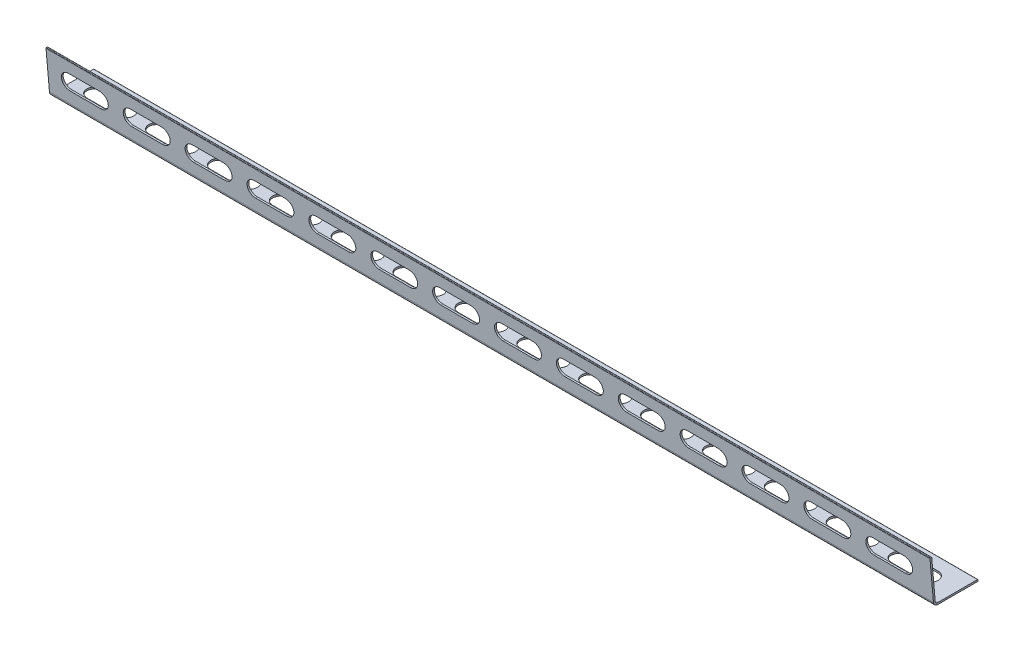
from build123d import *

# Parameters (mm, degrees)
EXTRUDE_1_DEPTH     = 1000
CUT_EXTRUDE_3_DEPTH = 1003.594743762
CUT_EXTRUDE_5_DEPTH = 1003.62092087


with BuildPart() as part:
    # 草图1 → 凸台-拉伸1 (new body)
    with BuildSketch(Plane(origin=(0, 0, 0), x_dir=(0, 0, -1), z_dir=(1, 0, 0))):
        with BuildLine():
            Line((-0.5, 0), (-45.41834413, 0))
            ThreePointArc((-45.41834413, 0), (-48.796295168, 1.313613316), (-50.39931762, 4.564221286))
            Line((-50.39931762, 4.564221286), (-54.314209266, 49.311637556))
            ThreePointArc((-54.314209266, 49.311637556), (-54.199134139, 49.676609232), (-53.859689788, 49.853312776))
            Line((-53.859689788, 49.853312776), (-52.86349509, 49.940468519))
            ThreePointArc((-52.86349509, 49.940468519), (-52.498523414, 49.825393391), (-52.32181987, 49.485949041))
            Line((-52.32181987, 49.485949041), (-48.406928224, 4.738532772))
            ThreePointArc((-48.406928224, 4.738532772), (-47.445114753, 2.78816799), (-45.41834413, 2))
            Line((-45.41834413, 2), (-0.5, 2))
            ThreePointArc((-0.5, 2), (-0.146446609, 1.853553391), (0, 1.5))
            Line((0, 1.5), (0, 0.5))
            ThreePointArc((0, 0.5), (-0.146446609, 0.146446609), (-0.5, 0))
        make_face()
    extrude(amount=EXTRUDE_1_DEPTH)

    # 草图3 → 切除-拉伸3 (cut, through all)
    with BuildSketch(Plane(origin=(0, -4.166892956, 47.627804429), x_dir=(-1, 0, 0), z_dir=(0, 0.08715574274765506, -0.9961946980917459))):
        with BuildLine():
            Line((-59.5, 40.939443007), (-24.5, 40.939443007))
            ThreePointArc((-24.5, 40.939443007), (-15.5, 31.939443007), (-24.5, 22.939443007))
            Line((-24.5, 22.939443007), (-59.5, 22.939443007))
            ThreePointArc((-59.5, 22.939443007), (-68.5, 31.939443007), (-59.5, 40.939443007))
        make_face()
        with BuildLine():
            Line((-129.5, 40.939443007), (-94.5, 40.939443007))
            ThreePointArc((-94.5, 40.939443007), (-85.5, 31.939443007), (-94.5, 22.939443007))
            Line((-94.5, 22.939443007), (-129.5, 22.939443007))
            ThreePointArc((-129.5, 22.939443007), (-138.5, 31.939443007), (-129.5, 40.939443007))
        make_face()
        with BuildLine():
            Line((-199.5, 40.939443007), (-164.5, 40.939443007))
            ThreePointArc((-164.5, 40.939443007), (-155.5, 31.939443007), (-164.5, 22.939443007))
            Line((-164.5, 22.939443007), (-199.5, 22.939443007))
            ThreePointArc((-199.5, 22.939443007), (-208.5, 31.939443007), (-199.5, 40.939443007))
        make_face()
        with BuildLine():
            Line((-269.5, 40.939443007), (-234.5, 40.939443007))
            ThreePointArc((-234.5, 40.939443007), (-225.5, 31.939443007), (-234.5, 22.939443007))
            Line((-234.5, 22.939443007), (-269.5, 22.939443007))
            ThreePointArc((-269.5, 22.939443007), (-278.5, 31.939443007), (-269.5, 40.939443007))
        make_face()
        with BuildLine():
            Line((-339.5, 40.939443007), (-304.5, 40.939443007))
            ThreePointArc((-304.5, 40.939443007), (-295.5, 31.939443007), (-304.5, 22.939443007))
            Line((-304.5, 22.939443007), (-339.5, 22.939443007))
            ThreePointArc((-339.5, 22.939443007), (-348.5, 31.939443007), (-339.5, 40.939443007))
        make_face()
        with BuildLine():
            Line((-409.5, 40.939443007), (-374.5, 40.939443007))
            ThreePointArc((-374.5, 40.939443007), (-365.5, 31.939443007), (-374.5, 22.939443007))
            Line((-374.5, 22.939443007), (-409.5, 22.939443007))
            ThreePointArc((-409.5, 22.939443007), (-418.5, 31.939443007), (-409.5, 40.939443007))
        make_face()
        with BuildLine():
            Line((-479.5, 40.939443007), (-444.5, 40.939443007))
            ThreePointArc((-444.5, 40.939443007), (-435.5, 31.939443007), (-444.5, 22.939443007))
            Line((-444.5, 22.939443007), (-479.5, 22.939443007))
            ThreePointArc((-479.5, 22.939443007), (-488.5, 31.939443007), (-479.5, 40.939443007))
        make_face()
        with BuildLine():
            Line((-549.5, 40.939443007), (-514.5, 40.939443007))
            ThreePointArc((-514.5, 40.939443007), (-505.5, 31.939443007), (-514.5, 22.939443007))
            Line((-514.5, 22.939443007), (-549.5, 22.939443007))
            ThreePointArc((-549.5, 22.939443007), (-558.5, 31.939443007), (-549.5, 40.939443007))
        make_face()
        with BuildLine():
            Line((-619.5, 40.939443007), (-584.5, 40.939443007))
            ThreePointArc((-584.5, 40.939443007), (-575.5, 31.939443007), (-584.5, 22.939443007))
            Line((-584.5, 22.939443007), (-619.5, 22.939443007))
            ThreePointArc((-619.5, 22.939443007), (-628.5, 31.939443007), (-619.5, 40.939443007))
        make_face()
        with BuildLine():
            Line((-689.5, 40.939443007), (-654.5, 40.939443007))
            ThreePointArc((-654.5, 40.939443007), (-645.5, 31.939443007), (-654.5, 22.939443007))
            Line((-654.5, 22.939443007), (-689.5, 22.939443007))
            ThreePointArc((-689.5, 22.939443007), (-698.5, 31.939443007), (-689.5, 40.939443007))
        make_face()
        with BuildLine():
            Line((-759.5, 40.939443007), (-724.5, 40.939443007))
            ThreePointArc((-724.5, 40.939443007), (-715.5, 31.939443007), (-724.5, 22.939443007))
            Line((-724.5, 22.939443007), (-759.5, 22.939443007))
            ThreePointArc((-759.5, 22.939443007), (-768.5, 31.939443007), (-759.5, 40.939443007))
        make_face()
        with BuildLine():
            Line((-829.5, 40.939443007), (-794.5, 40.939443007))
            ThreePointArc((-794.5, 40.939443007), (-785.5, 31.939443007), (-794.5, 22.939443007))
            Line((-794.5, 22.939443007), (-829.5, 22.939443007))
            ThreePointArc((-829.5, 22.939443007), (-838.5, 31.939443007), (-829.5, 40.939443007))
        make_face()
        with BuildLine():
            Line((-899.5, 40.939443007), (-864.5, 40.939443007))
            ThreePointArc((-864.5, 40.939443007), (-855.5, 31.939443007), (-864.5, 22.939443007))
            Line((-864.5, 22.939443007), (-899.5, 22.939443007))
            ThreePointArc((-899.5, 22.939443007), (-908.5, 31.939443007), (-899.5, 40.939443007))
        make_face()
        with BuildLine():
            Line((-969.5, 40.939443007), (-934.5, 40.939443007))
            ThreePointArc((-934.5, 40.939443007), (-925.5, 31.939443007), (-934.5, 22.939443007))
            Line((-934.5, 22.939443007), (-969.5, 22.939443007))
            ThreePointArc((-969.5, 22.939443007), (-978.5, 31.939443007), (-969.5, 40.939443007))
        make_face()
    extrude(amount=-CUT_EXTRUDE_3_DEPTH, mode=Mode.SUBTRACT)

    # 草图2 → 切除-拉伸5 (cut, through all)
    with BuildSketch(Plane(origin=(0, 2, 0), x_dir=(1, 0, 0), z_dir=(0, 1, 0))):
        with BuildLine():
            Line((59.5, -14.5), (24.5, -14.5))
            ThreePointArc((24.5, -14.5), (15.5, -23.5), (24.5, -32.5))
            Line((24.5, -32.5), (59.5, -32.5))
            ThreePointArc((59.5, -32.5), (68.5, -23.5), (59.5, -14.5))
        make_face()
        with BuildLine():
            Line((129.5, -14.5), (94.5, -14.5))
            ThreePointArc((94.5, -14.5), (85.5, -23.5), (94.5, -32.5))
            Line((94.5, -32.5), (129.5, -32.5))
            ThreePointArc((129.5, -32.5), (138.5, -23.5), (129.5, -14.5))
        make_face()
        with BuildLine():
            Line((199.5, -14.5), (164.5, -14.5))
            ThreePointArc((164.5, -14.5), (155.5, -23.5), (164.5, -32.5))
            Line((164.5, -32.5), (199.5, -32.5))
            ThreePointArc((199.5, -32.5), (208.5, -23.5), (199.5, -14.5))
        make_face()
        with BuildLine():
            Line((269.5, -14.5), (234.5, -14.5))
            ThreePointArc((234.5, -14.5), (225.5, -23.5), (234.5, -32.5))
            Line((234.5, -32.5), (269.5, -32.5))
            ThreePointArc((269.5, -32.5), (278.5, -23.5), (269.5, -14.5))
        make_face()
        with BuildLine():
            Line((339.5, -14.5), (304.5, -14.5))
            ThreePointArc((304.5, -14.5), (295.5, -23.5), (304.5, -32.5))
            Line((304.5, -32.5), (339.5, -32.5))
            ThreePointArc((339.5, -32.5), (348.5, -23.5), (339.5, -14.5))
        make_face()
        with BuildLine():
            Line((409.5, -14.5), (374.5, -14.5))
            ThreePointArc((374.5, -14.5), (365.5, -23.5), (374.5, -32.5))
            Line((374.5, -32.5), (409.5, -32.5))
            ThreePointArc((409.5, -32.5), (418.5, -23.5), (409.5, -14.5))
        make_face()
        with BuildLine():
            Line((479.5, -14.5), (444.5, -14.5))
            ThreePointArc((444.5, -14.5), (435.5, -23.5), (444.5, -32.5))
            Line((444.5, -32.5), (479.5, -32.5))
            ThreePointArc((479.5, -32.5), (488.5, -23.5), (479.5, -14.5))
        make_face()
        with BuildLine():
            Line((549.5, -14.5), (514.5, -14.5))
            ThreePointArc((514.5, -14.5), (505.5, -23.5), (514.5, -32.5))
            Line((514.5, -32.5), (549.5, -32.5))
            ThreePointArc((549.5, -32.5), (558.5, -23.5), (549.5, -14.5))
        make_face()
        with BuildLine():
            Line((619.5, -14.5), (584.5, -14.5))
            ThreePointArc((584.5, -14.5), (575.5, -23.5), (584.5, -32.5))
            Line((584.5, -32.5), (619.5, -32.5))
            ThreePointArc((619.5, -32.5), (628.5, -23.5), (619.5, -14.5))
        make_face()
        with BuildLine():
            Line((689.5, -14.5), (654.5, -14.5))
            ThreePointArc((654.5, -14.5), (645.5, -23.5), (654.5, -32.5))
            Line((654.5, -32.5), (689.5, -32.5))
            ThreePointArc((689.5, -32.5), (698.5, -23.5), (689.5, -14.5))
        make_face()
        with BuildLine():
            Line((759.5, -14.5), (724.5, -14.5))
            ThreePointArc((724.5, -14.5), (715.5, -23.5), (724.5, -32.5))
            Line((724.5, -32.5), (759.5, -32.5))
            ThreePointArc((759.5, -32.5), (768.5, -23.5), (759.5, -14.5))
        make_face()
        with BuildLine():
            Line((829.5, -14.5), (794.5, -14.5))
            ThreePointArc((794.5, -14.5), (785.5, -23.5), (794.5, -32.5))
            Line((794.5, -32.5), (829.5, -32.5))
            ThreePointArc((829.5, -32.5), (838.5, -23.5), (829.5, -14.5))
        make_face()
        with BuildLine():
            Line((899.5, -14.5), (864.5, -14.5))
            ThreePointArc((864.5, -14.5), (855.5, -23.5), (864.5, -32.5))
            Line((864.5, -32.5), (899.5, -32.5))
            ThreePointArc((899.5, -32.5), (908.5, -23.5), (899.5, -14.5))
        make_face()
        with BuildLine():
            Line((969.5, -14.5), (934.5, -14.5))
            ThreePointArc((934.5, -14.5), (925.5, -23.5), (934.5, -32.5))
            Line((934.5, -32.5), (969.5, -32.5))
            ThreePointArc((969.5, -32.5), (978.5, -23.5), (969.5, -14.5))
        make_face()
    extrude(amount=-CUT_EXTRUDE_5_DEPTH, mode=Mode.SUBTRACT)


solid = part.part
